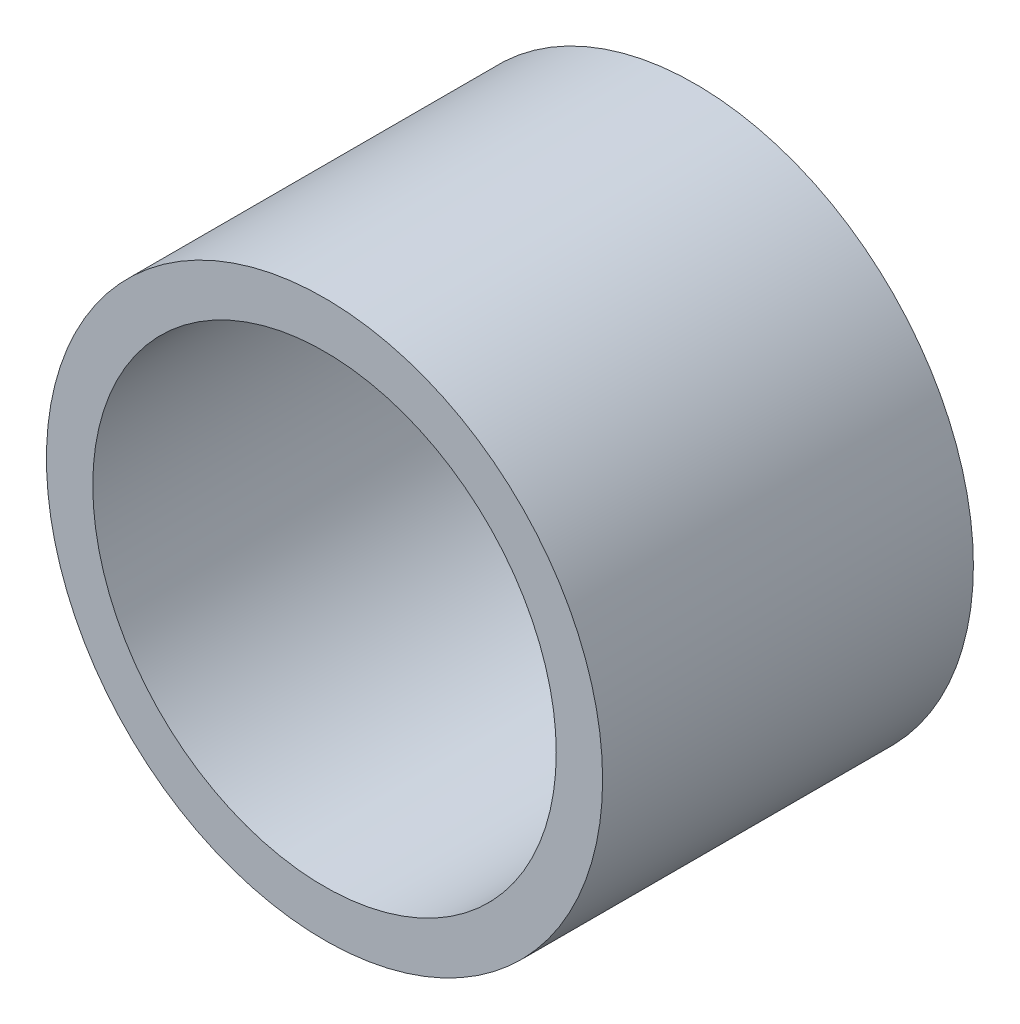
from build123d import *

# Parameters (mm, degrees)
SKETCH1_R           = 38.1
SKETCH1_R_2         = 31.75
BOSS_EXTRUDE1_DEPTH = 50.8


with BuildPart() as part:
    # Sketch1 → Boss-Extrude1 (new body)
    with BuildSketch(Plane.XY):
        Circle(SKETCH1_R)
        Circle(SKETCH1_R_2, mode=Mode.SUBTRACT)
    extrude(amount=BOSS_EXTRUDE1_DEPTH)


solid = part.part
